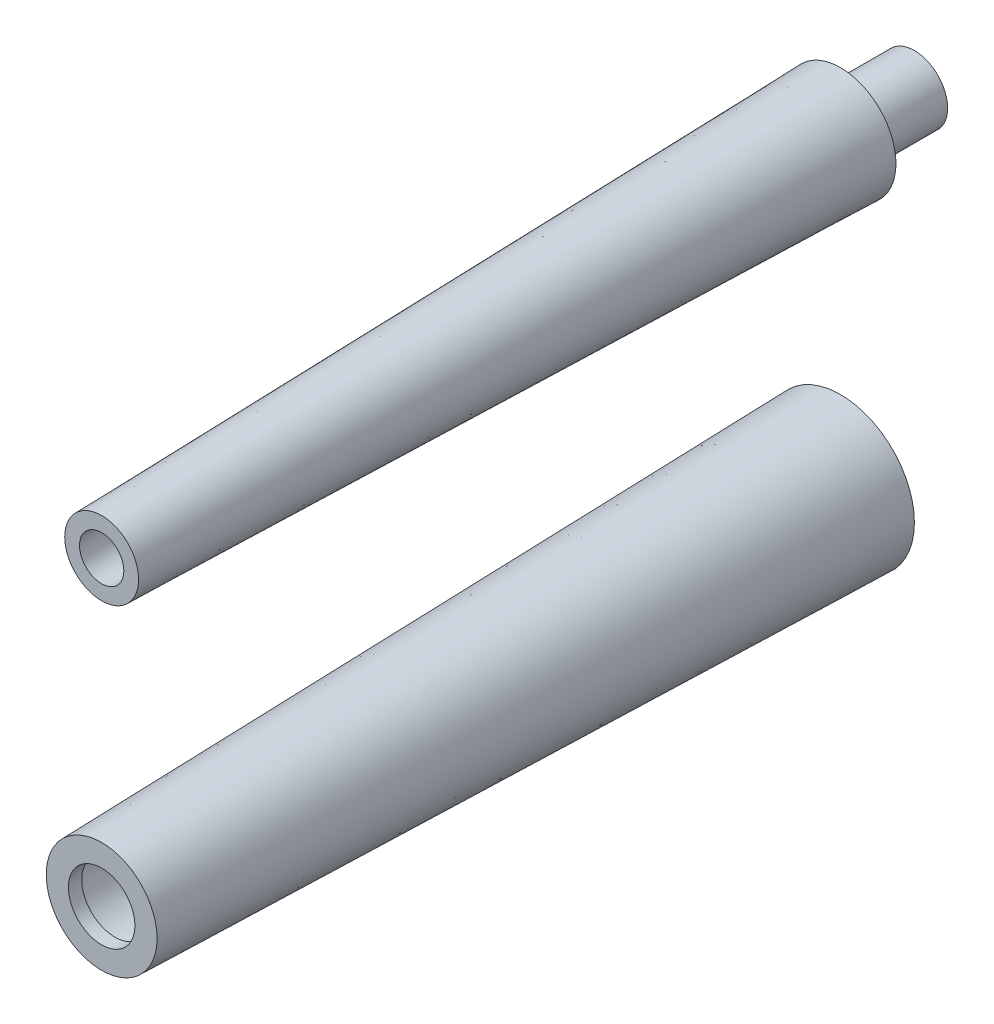
from build123d import *
from build123d.topology import SkipClean

# Parameters (mm, degrees)
SKETCH1_R             = 10
BOSS_EXTRUDE1_DEPTH   = 100
SKETCH1_R_2           = 7.5
BOSS_EXTRUDE1_2_DEPTH = 100
SHELL1_T              = -1.8
SHELL2_T              = -2
SKETCH4_R             = 4
CUT_EXTRUDE1_DEPTH    = 5
SKETCH5_R             = 4.5
CUT_EXTRUDE2_DEPTH    = 10
SKETCH6_R             = 4.5
SKETCH6_R_2           = 4
BOSS_EXTRUDE2_DEPTH   = 10


with BuildPart() as part:
    # Sketch1 → Boss-Extrude1 (new body)
    with BuildSketch(Plane.XY):
        with Locations((0, -25.12284227)):
            Circle(SKETCH1_R)
    extrude(amount=BOSS_EXTRUDE1_DEPTH)

    # Sketch2 → Cut-Revolve1 (revolve, cut)
    with BuildSketch(Plane(origin=(0, 0, 0), x_dir=(0, 0, -1), z_dir=(1, 0, 0)), mode=Mode.PRIVATE) as cut_revolve1_sk:
        Polygon((-100, -17.62284227), (0, -15.12284227), (0, -12.650397716), (-101.814601603, -12.650397716), align=None)
    revolve(cut_revolve1_sk.sketch.rotate(Axis((0, -25.12284227, 100), (0, 0, -1)), 90), axis=Axis((0, -25.12284227, 100), (0, 0, -1)), mode=Mode.SUBTRACT)

    # Shell1
    shell1_openings = [part.faces().sort_by_distance(p)[0] for p in [
        (0, -25.12284227, 0),
    ]]
    offset(amount=SHELL1_T, openings=shell1_openings, kind=Kind.INTERSECTION)

    # Sketch5 → Cut-Extrude2 (cut)
    with BuildSketch(Plane.XY.offset(100)):
        with Locations((0, -25.12284227)):
            Circle(SKETCH5_R)
    extrude(amount=-CUT_EXTRUDE2_DEPTH, mode=Mode.SUBTRACT)


with BuildPart() as body_2:
    # Sketch1 → Boss-Extrude1 2 (new body)
    with BuildSketch(Plane.XY):
        with Locations((0, 15.701730192)):
            Circle(SKETCH1_R_2)
    extrude(amount=BOSS_EXTRUDE1_2_DEPTH)

    # Sketch3 → Cut-Revolve2 (revolve, cut)
    with BuildSketch(Plane(origin=(0, 0, 0), x_dir=(0, 0, -1), z_dir=(1, 0, 0)), mode=Mode.PRIVATE) as cut_revolve2_sk:
        Polygon((0, 8.201730192), (-100, 10.701730192), (-103.648274883, 0.699875942), (0, 5.700803067), align=None)
    revolve(cut_revolve2_sk.sketch.rotate(Axis((0, 15.701730192, 0), (0, 0, 1)), 270), axis=Axis((0, 15.701730192, 0), (0, 0, 1)), mode=Mode.SUBTRACT)

    # Shell2
    shell2_openings = [body_2.faces().sort_by_distance(p)[0] for p in [
        (0, 15.701730192, 100),
    ]]
    offset(amount=SHELL2_T, openings=shell2_openings, kind=Kind.INTERSECTION)

    # Sketch4 → Cut-Extrude1 (cut, symmetric)
    with BuildSketch(Plane(origin=(0, 0, 0), x_dir=(-1, 0, 0), z_dir=(0, 0, -1))):
        with Locations(Location((0, 15.701730192, 0), (0, 0, 180))):
            Circle(SKETCH4_R)
    extrude(amount=CUT_EXTRUDE1_DEPTH, both=True, mode=Mode.SUBTRACT)

    # Sketch6 → Boss-Extrude2 (add)
    with SkipClean():  # the faces are left unmerged after this step: merging them gives an invalid solid
        with BuildSketch(Plane(origin=(0, 0, 0), x_dir=(-1, 0, 0), z_dir=(0, 0, -1))):
            with Locations(Location((0, 15.701730192, 0), (0, 0, 180))):
                Circle(SKETCH6_R)
            with Locations((0, 15.701730192)):
                Circle(SKETCH6_R_2, mode=Mode.SUBTRACT)
        extrude(amount=BOSS_EXTRUDE2_DEPTH)


solid = Compound([part.part, body_2.part])
